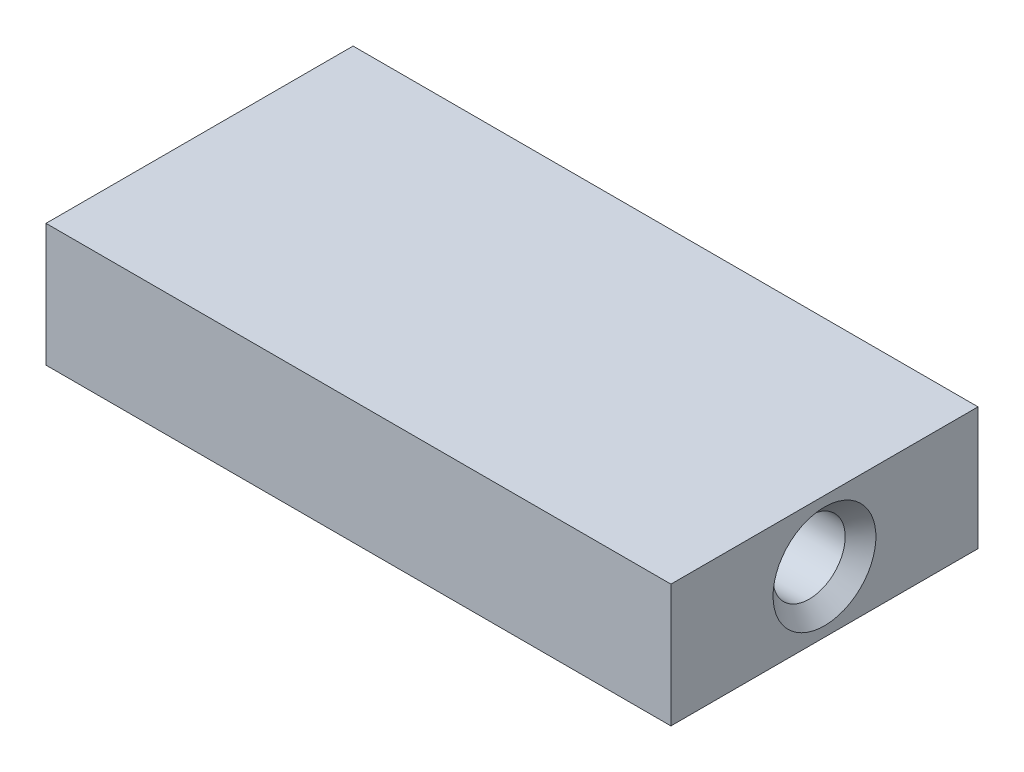
from build123d import *

# Parameters (mm, degrees)
SKETCH1_W           = 40.7
SKETCH1_H           = 20
BOSS_EXTRUDE1_DEPTH = 8
SKETCH2_R           = 2.35
CUT_EXTRUDE1_DEPTH  = 10
CUT_EXTRUDE2_START  = -10
SKETCH3_R           = 2.35
CUT_EXTRUDE2_DEPTH  = 10
CHAMFER1_SIZE       = 1


with BuildPart() as part:
    # Sketch1 → Boss-Extrude1 (new body)
    with BuildSketch(Plane(origin=(0, 0, 0), x_dir=(1, 0, 0), z_dir=(0, 1, 0))):
        Rectangle(SKETCH1_W, SKETCH1_H)
    extrude(amount=BOSS_EXTRUDE1_DEPTH)

    # Sketch2 → Cut-Extrude1 (cut)
    with BuildSketch(Plane(origin=(20.35, 0, 0), x_dir=(0, 0, -1), z_dir=(1, 0, 0))):
        with Locations((0, 4)):
            Circle(SKETCH2_R)
    extrude(amount=-CUT_EXTRUDE1_DEPTH, mode=Mode.SUBTRACT)

    # Sketch3 → Cut-Extrude2 (cut)
    with BuildSketch(Plane.ZY.offset(20.35).offset(CUT_EXTRUDE2_START)):
        with Locations(Location((0, 4, 0), (0, 0, 180))):
            Circle(SKETCH3_R)
    extrude(amount=CUT_EXTRUDE2_DEPTH, mode=Mode.SUBTRACT)

    # Chamfer1
    chamfer1_edges = [part.edges().sort_by_distance(p)[0] for p in [
        (20.35, 4, 2.35),
        (-20.35, 4, 2.35),
    ]]
    chamfer(chamfer1_edges, length=CHAMFER1_SIZE)


solid = part.part
